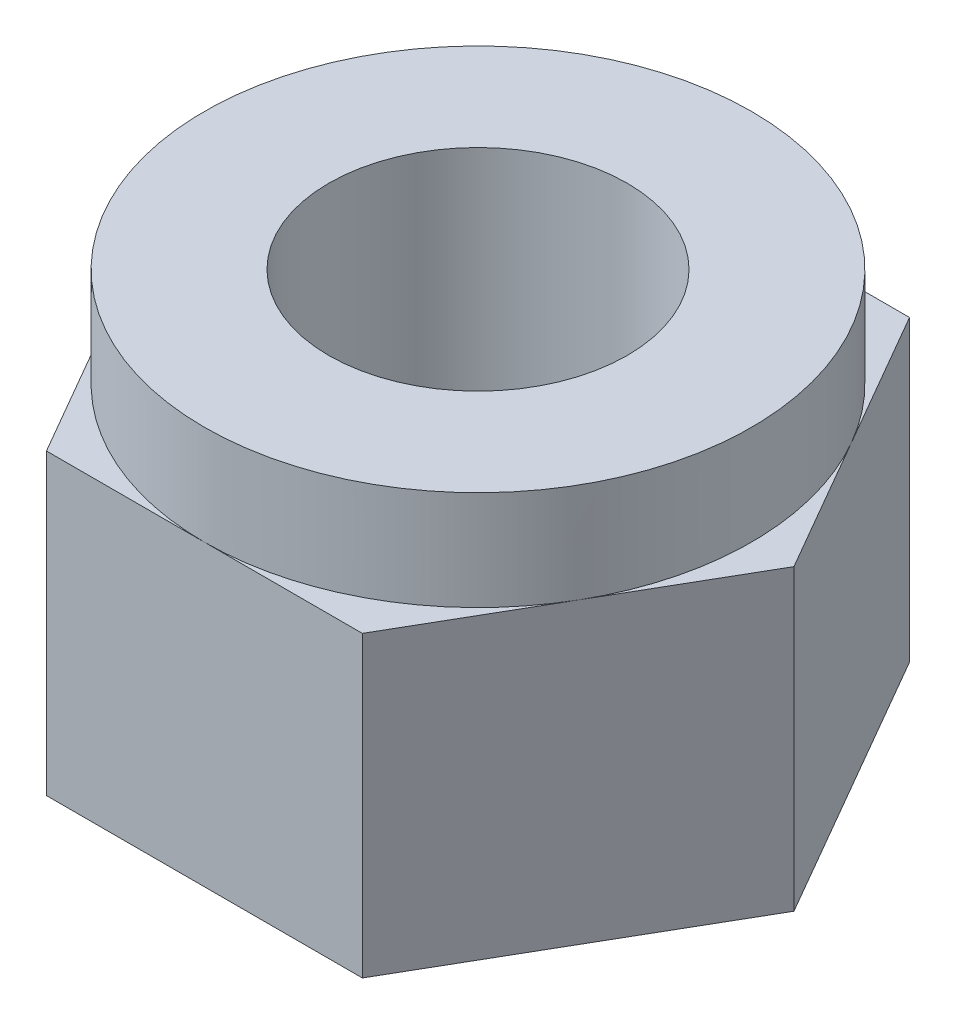
from build123d import *

# Parameters (mm, degrees)
EXTRUDE_1_DEPTH     = 3
SKETCH_2_R          = 2.75
EXTRUDE_2_DEPTH     = 1
SKETCH_3_R          = 1.5
CUT_EXTRUDE_1_DEPTH = 6.800502852


with BuildPart() as part:
    # 草图1 → 凸台-拉伸1 (new body)
    with BuildSketch(Plane(origin=(0, 0, 0), x_dir=(1, 0, 0), z_dir=(0, 1, 0))):
        Polygon((3.175426481, 0), (1.58771324, 2.75), (-1.58771324, 2.75), (-3.175426481, 0), (-1.58771324, -2.75), (1.58771324, -2.75), align=None)
    extrude(amount=EXTRUDE_1_DEPTH)

    # 草图2 → 凸台-拉伸2 (add)
    with BuildSketch(Plane(origin=(0, 3, 0), x_dir=(1, 0, 0), z_dir=(0, 1, 0))):
        Circle(SKETCH_2_R)
    extrude(amount=EXTRUDE_2_DEPTH)

    # 草图3 → 切除-拉伸1 (cut, through all)
    with BuildSketch(Plane.XZ):
        Circle(SKETCH_3_R)
    extrude(amount=-CUT_EXTRUDE_1_DEPTH, mode=Mode.SUBTRACT)


solid = part.part
